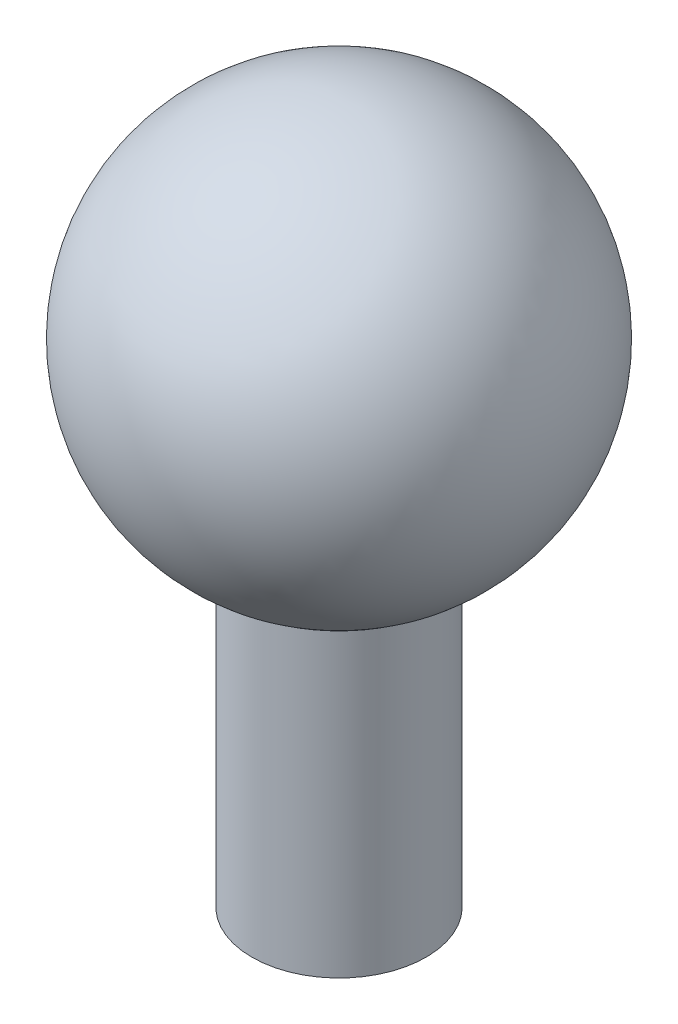
from build123d import *

# Parameters (mm, degrees)
SKETCH1_R           = 1
BOSS_EXTRUDE1_DEPTH = 3.5


with BuildPart() as part:
    # Sketch1 → Boss-Extrude1 (new body)
    with BuildSketch(Plane(origin=(0, 0, 0), x_dir=(1, 0, 0), z_dir=(0, 1, 0))):
        with Locations(Location((0, 0, 0), (0, 0, 270))):
            Circle(SKETCH1_R)
    extrude(amount=BOSS_EXTRUDE1_DEPTH)

    # Sketch2 → Revolve2 (revolve)
    with BuildSketch(Plane.XY):
        with BuildLine():
            Line((0, 3.276604446), (0, 8.026604446))
            ThreePointArc((0, 8.026604446), (-2.375, 5.651604446), (0, 3.276604446))
        make_face()
    revolve(axis=Axis((0, 3.276604446, 0), (0, 1, 0)))


solid = part.part
